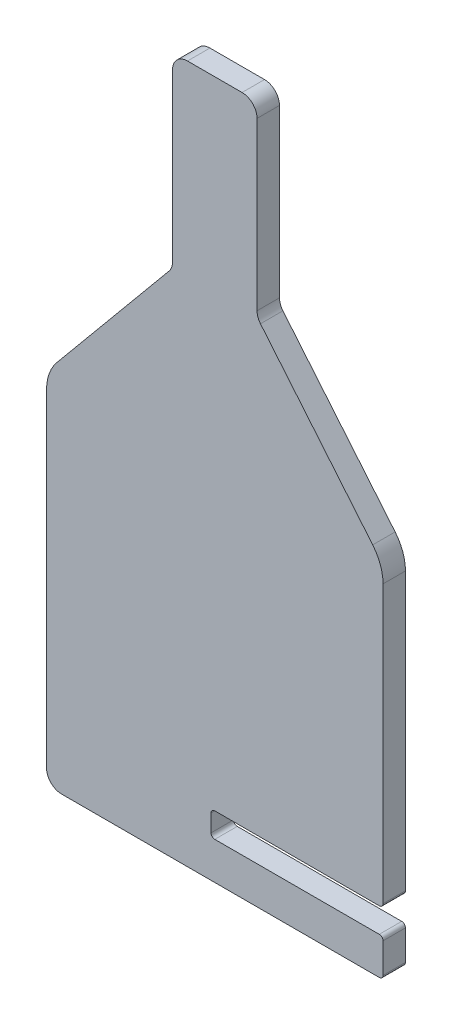
from build123d import *

# Parameters (mm, degrees)
SALIENTE_EXTRUIR1_DEPTH = 3
CROQUIS3_W              = 23
CROQUIS3_H              = 3.3
CORTAR_EXTRUIR2_DEPTH   = 3
REDONDEO1_R             = 2
REDONDEO2_R             = 6
REDONDEO3_R             = 0.5


with BuildPart() as part:
    # Croquis1 → Saliente-Extruir1 (new body)
    with BuildSketch(Plane.XY):
        Polygon((-5.65, 20), (-22.5, -0.323324039), (-22.5, -48.323324039), (22.5, -48.323324039), (22.5, -0.323324039), (5.65, 19.999061555), (5.65, 45), (-5.65, 45), align=None)
    extrude(amount=SALIENTE_EXTRUIR1_DEPTH)

    # Croquis3 → Cortar-Extruir2 (cut)
    with BuildSketch(Plane.XY.offset(3)):
        with Locations((11, -41.673324039)):
            Rectangle(CROQUIS3_W, CROQUIS3_H)
    extrude(amount=-CORTAR_EXTRUIR2_DEPTH, mode=Mode.SUBTRACT)

    # Redondeo1
    redondeo1_edges = [part.edges().sort_by_distance(p)[0] for p in [
        (-5.65, 45, 1.5),
        (-5.65, 20, 1.5),
        (-22.5, -48.323324039, 1.5),
        (5.65, 19.999061555, 1.5),
        (5.65, 45, 1.5),
    ]]
    fillet(redondeo1_edges, radius=REDONDEO1_R)

    # Redondeo2
    redondeo2_edges = [part.edges().sort_by_distance(p)[0] for p in [
        (-22.5, -0.323324039, 1.5),
        (22.5, -0.323324039, 1.5),
    ]]
    fillet(redondeo2_edges, radius=REDONDEO2_R)

    # Redondeo3
    redondeo3_edges = [part.edges().sort_by_distance(p)[0] for p in [
        (22.5, -48.323324039, 1.5),
        (-0.5, -40.023324039, 1.5),
        (-0.5, -43.323324039, 1.5),
        (22.5, -43.323324039, 1.5),
        (22.5, -40.023324039, 1.5),
    ]]
    fillet(redondeo3_edges, radius=REDONDEO3_R)


solid = part.part
